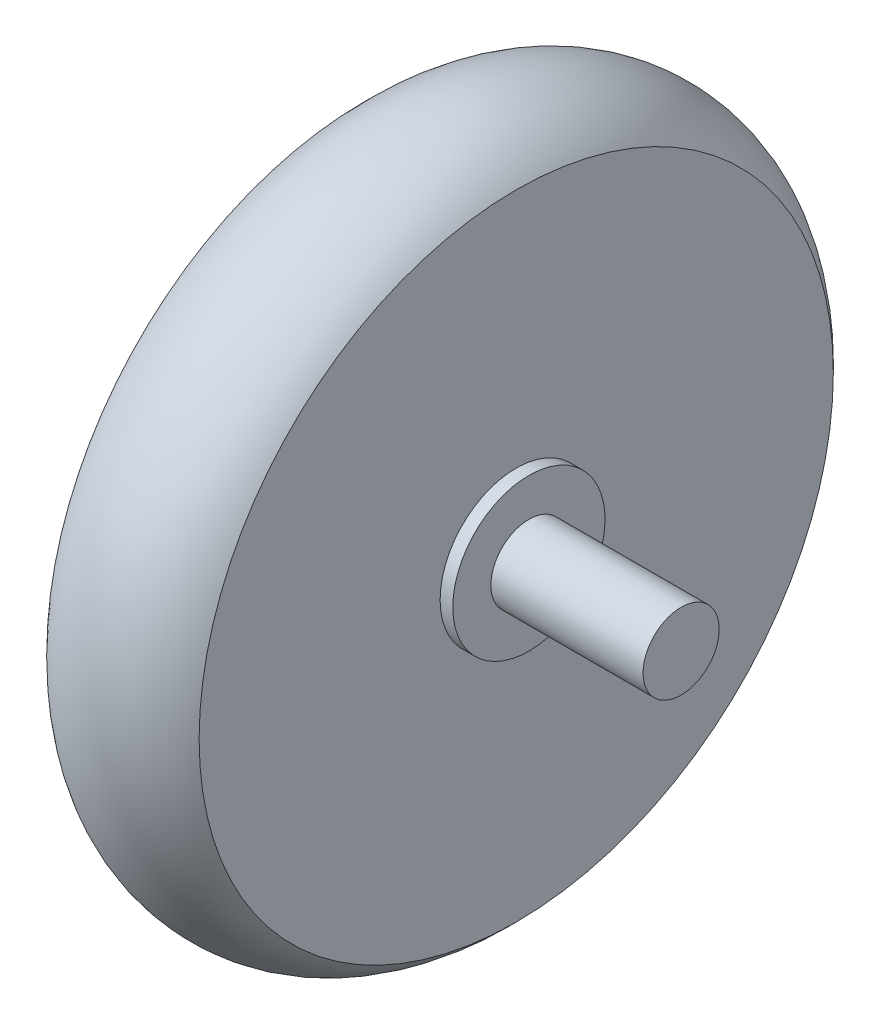
from build123d import *


with BuildPart() as part:
    # 草图1 → 旋转1 (revolve)
    with BuildSketch(Plane(origin=(0, 0, 0), x_dir=(1, 0, 0), z_dir=(0, 1, 0)), mode=Mode.PRIVATE) as revolve_1_sk:
        with BuildLine():
            Line((0, 25), (0, 10))
            Line((0, 10), (2, 10))
            Line((2, 10), (2, 0))
            Line((2, 0), (25, 0))
            Line((25, 0), (25, 3))
            Line((25, 3), (13, 3))
            Line((13, 3), (13, 6))
            Line((13, 6), (12, 6))
            Line((12, 6), (12, 25))
            ThreePointArc((12, 25), (6, 27.708497378), (0, 25))
        make_face()
    revolve(revolve_1_sk.sketch.rotate(Axis((0, 0, 0), (1, 0, 0)), 180), axis=Axis((0, 0, 0), (1, 0, 0)))


solid = part.part
